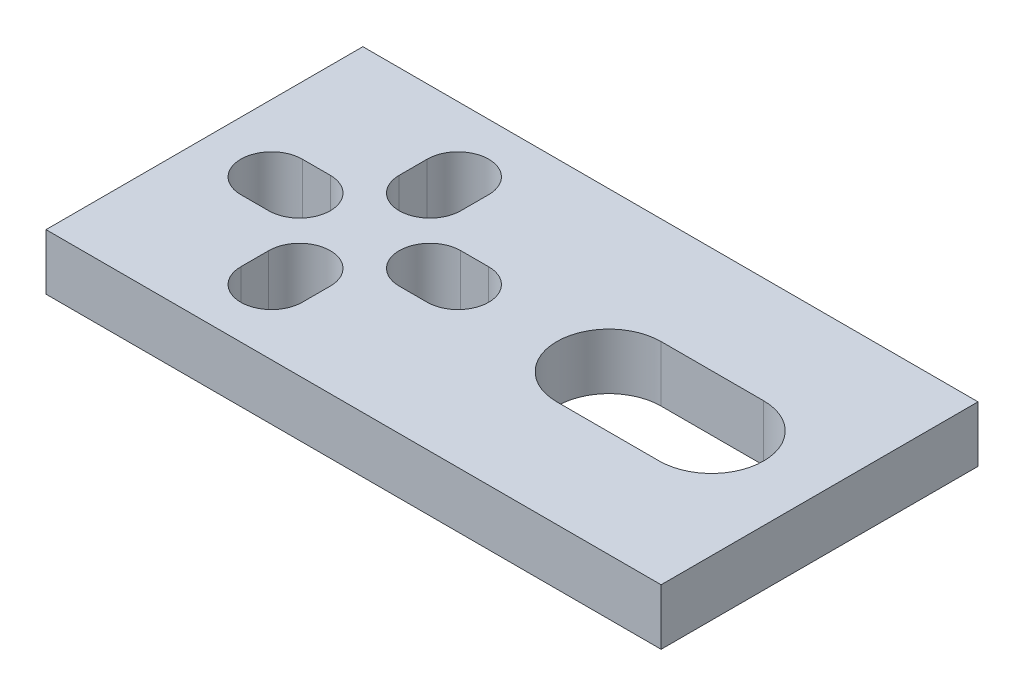
from build123d import *

# Parameters (mm, degrees)
SKETCH1_W           = 33
SKETCH1_H           = 17
BOSS_EXTRUDE1_DEPTH = 3
CUT_EXTRUDE1_DEPTH  = 38.242448899


with BuildPart() as part:
    # Sketch1 → Boss-Extrude1 (new body)
    with BuildSketch(Plane(origin=(0, 0, 0), x_dir=(1, 0, 0), z_dir=(0, 1, 0))):
        with Locations((16.5, 8.5)):
            Rectangle(SKETCH1_W, SKETCH1_H)
    extrude(amount=BOSS_EXTRUDE1_DEPTH)

    # Sketch2 → Cut-Extrude1 (cut, through all)
    with BuildSketch(Plane(origin=(0, 3, 0), x_dir=(1, 0, 0), z_dir=(0, 1, 0))):
        with BuildLine():
            Line((21.7, 11.3), (27.2, 11.3))
            ThreePointArc((27.2, 11.3), (30, 8.5), (27.2, 5.7))
            Line((27.2, 5.7), (21.7, 5.7))
            ThreePointArc((21.7, 5.7), (18.9, 8.5), (21.7, 11.3))
        make_face()
        with BuildLine():
            Line((6.95, 12), (6.95, 13.5))
            ThreePointArc((6.95, 13.5), (8.6, 15.15), (10.25, 13.5))
            Line((10.25, 13.5), (10.25, 12))
            ThreePointArc((10.25, 12), (8.6, 10.35), (6.95, 12))
        make_face()
        with BuildLine():
            Line((3.6, 10.15), (5.1, 10.15))
            ThreePointArc((5.1, 10.15), (6.75, 8.5), (5.1, 6.85))
            Line((5.1, 6.85), (3.6, 6.85))
            ThreePointArc((3.6, 6.85), (1.95, 8.5), (3.6, 10.15))
        make_face()
        with BuildLine():
            Line((13.6, 10.15), (12.1, 10.15))
            ThreePointArc((12.1, 10.15), (10.45, 8.5), (12.1, 6.85))
            Line((12.1, 6.85), (13.6, 6.85))
            ThreePointArc((13.6, 6.85), (15.25, 8.5), (13.6, 10.15))
        make_face()
        with BuildLine():
            Line((6.95, 5), (6.95, 3.5))
            ThreePointArc((6.95, 3.5), (8.6, 1.85), (10.25, 3.5))
            Line((10.25, 3.5), (10.25, 5))
            ThreePointArc((10.25, 5), (8.6, 6.65), (6.95, 5))
        make_face()
    extrude(amount=-CUT_EXTRUDE1_DEPTH, mode=Mode.SUBTRACT)


solid = part.part
